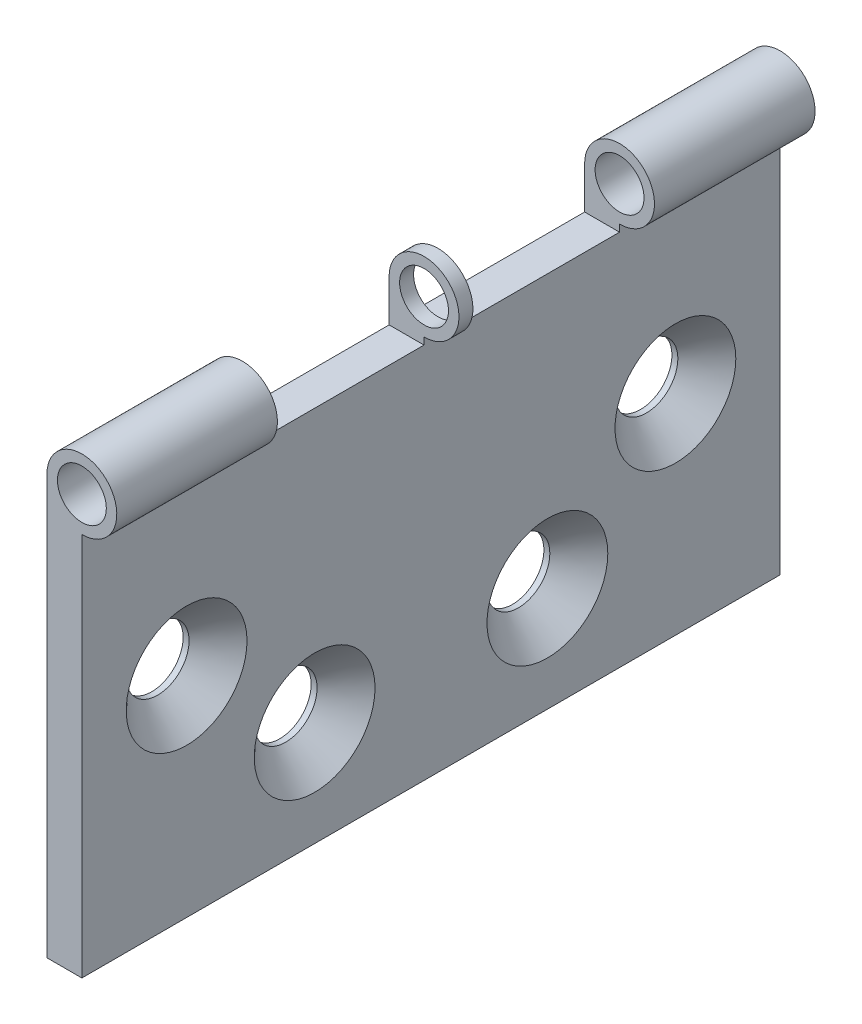
from build123d import *

# Parameters (mm, degrees)
SKETCH1_W                                      = 5
SKETCH1_H                                      = 60
EXTRUDE_THIN1_DEPTH                            = 50
SKETCH2_R                                      = 5
SKETCH3_R                                      = 3.5
CUT_EXTRUDE1_DEPTH                             = 120.687092036
CSK_FOR_M8_FLAT_HEAD_MACHINE_SCREW1_AT_2_COUNT = 2
CSK_FOR_M8_FLAT_HEAD_MACHINE_SCREW1_AT_2_PITCH = 23.687784006
F_2CUTS_DEPTH                                  = 83.158383626
F_2CUTS_DEPTH_BACK                             = 83.158383626
SKETCH8_W                                      = 26
SKETCH8_H                                      = 11


with BuildPart() as part:
    # Sketch1 → Extrude-Thin1 (new, symmetric)
    with BuildSketch(Plane.XY):
        with Locations((2.5, 30)):
            Rectangle(SKETCH1_W, SKETCH1_H)
    extrude(amount=EXTRUDE_THIN1_DEPTH, both=True)

    # Sweep1: sweep along a curve in space
    with BuildLine() as sweep1_path:
        Line((0, 60, 50), (0, 60, -50))
    # Sketch2 → Sweep1 (sweep)
    with BuildSketch(Plane.XY.offset(50)):
        with Locations((5, 60)):
            Circle(SKETCH2_R)
    sweep(path=sweep1_path.line)

    # Sketch3 → Cut-Extrude1 (cut, through all)
    with BuildSketch(Plane.XY.offset(50)):
        with Locations((5, 60)):
            Circle(SKETCH3_R)
    extrude(amount=-CUT_EXTRUDE1_DEPTH, mode=Mode.SUBTRACT)

    # Sketch5 → CSK for M8 Flat Head Machine Screw1 (revolve, cut)
    with BuildSketch(Plane(origin=(5, 30, 35), x_dir=(0, 0, -1), z_dir=(0, 1, 0))):
        Polygon((0, 0), (0, 5), (4.5, 5), (4.5, 4.15), (8.65, 0), align=None)
    csk_for_m8_flat_head_machine_screw1 = revolve(axis=Axis((11.35, 30, 35), (-1, 0, 0)), mode=Mode.SUBTRACT)

    # CSK for M8 Flat Head Machine Screw1 at 2: CSK for M8 Flat Head Machine Screw1 ×2
    with Locations(*[Vector(0, -0.6332377902572628, -0.773957299203321) * (i * CSK_FOR_M8_FLAT_HEAD_MACHINE_SCREW1_AT_2_PITCH) for i in range(1, CSK_FOR_M8_FLAT_HEAD_MACHINE_SCREW1_AT_2_COUNT)]):
        add(csk_for_m8_flat_head_machine_screw1, mode=Mode.SUBTRACT)

    # Mirror1: CSK for M8 Flat Head Machine Screw1 across plane
    add(csk_for_m8_flat_head_machine_screw1.mirror(Plane.XY), mode=Mode.SUBTRACT)

    # Mirror1 copy 1 sketch → Mirror1 copy 1 (revolve, cut)
    with BuildSketch(Plane(origin=(5, 15, -16.666666667), x_dir=(0, 0, 1), z_dir=(0, 1, 0))):
        Polygon((0, 0), (0, -5), (4.5, -5), (4.5, -4.15), (8.65, 0), align=None)
    revolve(axis=Axis((11.35, 15, -16.666666667), (1, 0, 0)), mode=Mode.SUBTRACT)

    # Sketch8 → 2Cuts (cut, two sides: drawn at the far end of the back side and taken through both)
    with BuildSketch(Plane(origin=(5, 0, 0), x_dir=(0, 0, -1), z_dir=(1, 0, 0)).offset(-F_2CUTS_DEPTH_BACK)):
        with Locations((-14, 59.5)):
            Rectangle(SKETCH8_W, SKETCH8_H)
        with Locations((14, 59.5)):
            Rectangle(SKETCH8_W, SKETCH8_H)
    extrude(amount=F_2CUTS_DEPTH + F_2CUTS_DEPTH_BACK, mode=Mode.SUBTRACT)


solid = part.part
